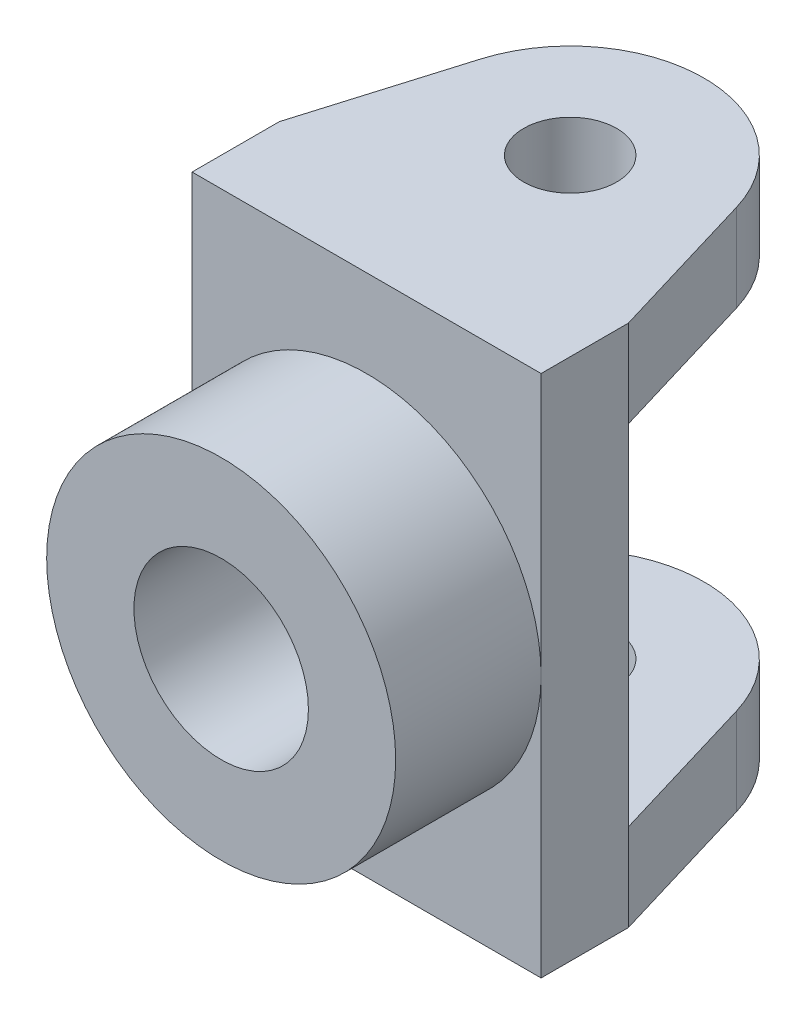
from build123d import *

# Parameters (mm, degrees)
SKETCH1_W           = 60
SKETCH1_H           = 90
BOSS_EXTRUDE1_DEPTH = 15
SKETCH2_R           = 30
BOSS_EXTRUDE2_DEPTH = 25
SKETCH3_R           = 8
BOSS_EXTRUDE3_DEPTH = 15


with BuildPart() as part:
    # Sketch1 → Boss-Extrude1 (new body)
    with BuildSketch(Plane.XY):
        Rectangle(SKETCH1_W, SKETCH1_H)
    extrude(amount=BOSS_EXTRUDE1_DEPTH)

    # Sketch2 → Boss-Extrude2 (add)
    with BuildSketch(Plane.XY.offset(15)):
        Circle(SKETCH2_R)
        with BuildLine():
            ThreePointArc((4, -14.456832295), (0, 15), (-4, -14.456832295))
            ThreePointArc((-4, -14.456832295), (0, -15), (4, -14.456832295))
        make_face(mode=Mode.SUBTRACT)
    extrude(amount=BOSS_EXTRUDE2_DEPTH)

    # Sketch3 → Boss-Extrude3 (add)
    with BuildSketch(Plane(origin=(0, 45, 0), x_dir=(1, 0, 0), z_dir=(0, 1, 0))):
        with BuildLine():
            Line((30, 0), (22.03289839, 26.599347585))
            ThreePointArc((22.03289839, 26.599347585), (0, 43), (-22.03289839, 26.599347585))
            Line((-22.03289839, 26.599347585), (-30, 0))
            Line((-30, 0), (30, 0))
        make_face()
        with Locations(Location((0, 20, 0), (0, 0, 180))):
            Circle(SKETCH3_R, mode=Mode.SUBTRACT)
    boss_extrude3 = extrude(amount=-BOSS_EXTRUDE3_DEPTH)

    # Mirror1: Boss-Extrude3 across plane
    add(boss_extrude3.mirror(Plane.ZX))


solid = part.part
